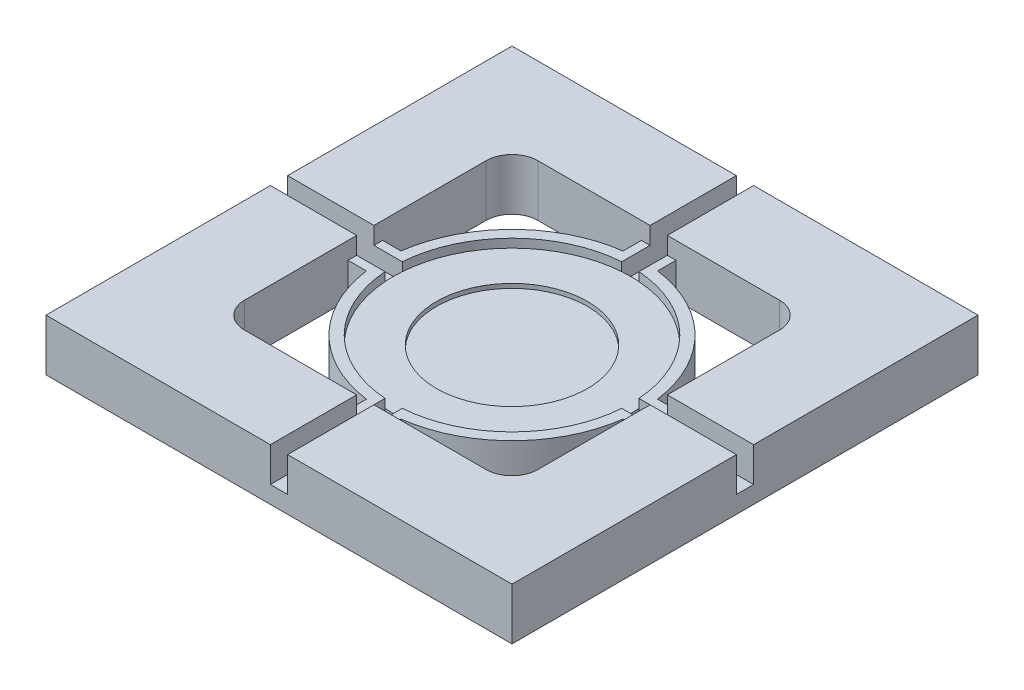
from build123d import *

# Parameters (mm, degrees)
SKETCH1_W             = 54
SKETCH1_H             = 54
BOSS_EXTRUDE1_DEPTH   = 10
CUT_EXTRUDE2_DEPTH    = 40.471508712
CUT_EXTRUDE3_DEPTH    = 2
SKETCH4_R             = 13.75
CUT_EXTRUDE4_DEPTH    = 1
SKETCH5_W             = 2
SKETCH5_H             = 10
SKETCH5_W_2           = 10
SKETCH5_H_2           = 2
CUT_EXTRUDE5_DEPTH    = 4
SKETCH7_R             = 8.75
CUT_EXTRUDE7_DEPTH    = 0.5
CROQUIS1_W            = 54
CROQUIS1_H            = 54
CORTAR_EXTRUIR1_DEPTH = 4


with BuildPart() as part:
    # Sketch1 → Boss-Extrude1 (new body)
    with BuildSketch(Plane(origin=(0, 0, 0), x_dir=(1, 0, 0), z_dir=(0, 1, 0))):
        Rectangle(SKETCH1_W, SKETCH1_H)
    extrude(amount=BOSS_EXTRUDE1_DEPTH)

    # Sketch2 → Cut-Extrude2 (cut, through all)
    with BuildSketch(Plane(origin=(0, 10, 0), x_dir=(1, 0, 0), z_dir=(0, 1, 0))):
        with BuildLine():
            ThreePointArc((-17, -14), (-16.121320344, -16.121320344), (-14, -17))
            Line((-14, -17), (-2, -17))
            Line((-2, -17), (-2, -14.866068747))
            ThreePointArc((-2, -14.866068747), (-10.606601718, -10.606601718), (-14.866068747, -2))
            Line((-14.866068747, -2), (-17, -2))
            Line((-17, -2), (-17, -14))
        make_face()
        with BuildLine():
            Line((2, -14.866068747), (2, -17))
            Line((2, -17), (14, -17))
            ThreePointArc((14, -17), (16.121320344, -16.121320344), (17, -14))
            Line((17, -14), (17, -2))
            Line((17, -2), (14.866068747, -2))
            ThreePointArc((14.866068747, -2), (10.606601718, -10.606601718), (2, -14.866068747))
        make_face()
        with BuildLine():
            Line((-17, 14), (-17, 2))
            Line((-17, 2), (-14.866068747, 2))
            ThreePointArc((-14.866068747, 2), (-10.606601718, 10.606601718), (-2, 14.866068747))
            Line((-2, 14.866068747), (-2, 17))
            Line((-2, 17), (-14, 17))
            ThreePointArc((-14, 17), (-16.121320344, 16.121320344), (-17, 14))
        make_face()
        with BuildLine():
            Line((14.866068747, 2), (17, 2))
            Line((17, 2), (17, 14))
            ThreePointArc((17, 14), (16.121320344, 16.121320344), (14, 17))
            Line((14, 17), (2, 17))
            Line((2, 17), (2, 14.866068747))
            ThreePointArc((2, 14.866068747), (10.606601718, 10.606601718), (14.866068747, 2))
        make_face()
    extrude(amount=-CUT_EXTRUDE2_DEPTH, mode=Mode.SUBTRACT)

    # Sketch3 → Cut-Extrude3 (cut)
    with BuildSketch(Plane(origin=(0, 10, 0), x_dir=(1, 0, 0), z_dir=(0, 1, 0))):
        with BuildLine():
            Line((-14, -17), (14, -17))
            ThreePointArc((14, -17), (16.121320344, -16.121320344), (17, -14))
            Line((17, -14), (17, 14))
            ThreePointArc((17, 14), (16.121320344, 16.121320344), (14, 17))
            Line((14, 17), (-14, 17))
            ThreePointArc((-14, 17), (-16.121320344, 16.121320344), (-17, 14))
            Line((-17, 14), (-17, -14))
            ThreePointArc((-17, -14), (-16.121320344, -16.121320344), (-14, -17))
        make_face()
    extrude(amount=-CUT_EXTRUDE3_DEPTH, mode=Mode.SUBTRACT)

    # Sketch4 → Cut-Extrude4 (cut)
    with BuildSketch(Plane(origin=(0, 8, 0), x_dir=(1, 0, 0), z_dir=(0, 1, 0))):
        with Locations(Location((0, 0, 0), (0, 0, 270))):
            Circle(SKETCH4_R)
    extrude(amount=-CUT_EXTRUDE4_DEPTH, mode=Mode.SUBTRACT)

    # Sketch5 → Cut-Extrude5 (cut)
    with BuildSketch(Plane(origin=(0, 10, 0), x_dir=(1, 0, 0), z_dir=(0, 1, 0))):
        with Locations((0, -22)):
            Rectangle(SKETCH5_W, SKETCH5_H)
        with BuildLine():
            Line((1, -17), (1, -13.713588152))
            ThreePointArc((1, -13.713588152), (0, -13.75), (-1, -13.713588152))
            Line((-1, -13.713588152), (-1, -17))
            Line((-1, -17), (1, -17))
        make_face()
        with Locations((22, 0)):
            Rectangle(SKETCH5_W_2, SKETCH5_H_2)
        with BuildLine():
            Line((17, 1), (13.713588152, 1))
            ThreePointArc((13.713588152, 1), (13.75, 0), (13.713588152, -1))
            Line((13.713588152, -1), (17, -1))
            Line((17, -1), (17, 1))
        make_face()
        with BuildLine():
            Line((1, 17), (-1, 17))
            Line((-1, 17), (-1, 13.713588152))
            ThreePointArc((-1, 13.713588152), (0, 13.75), (1, 13.713588152))
            Line((1, 13.713588152), (1, 17))
        make_face()
        with Locations((0, 22)):
            Rectangle(SKETCH5_W, SKETCH5_H)
        with Locations((-22, 0)):
            Rectangle(SKETCH5_W_2, SKETCH5_H_2)
        with BuildLine():
            Line((-13.713588152, 1), (-17, 1))
            Line((-17, 1), (-17, -1))
            Line((-17, -1), (-13.713588152, -1))
            ThreePointArc((-13.713588152, -1), (-13.75, 0), (-13.713588152, 1))
        make_face()
    extrude(amount=-CUT_EXTRUDE5_DEPTH, mode=Mode.SUBTRACT)

    # Sketch7 → Cut-Extrude7 (cut)
    with BuildSketch(Plane(origin=(0, 7, 0), x_dir=(1, 0, 0), z_dir=(0, 1, 0))):
        with Locations(Location((0, 0, 0), (0, 0, 270))):
            Circle(SKETCH7_R)
    extrude(amount=-CUT_EXTRUDE7_DEPTH, mode=Mode.SUBTRACT)

    # Croquis1 → Cortar-Extruir1 (cut)
    with BuildSketch(Plane.XZ):
        Rectangle(CROQUIS1_W, CROQUIS1_H)
    extrude(amount=-CORTAR_EXTRUIR1_DEPTH, mode=Mode.SUBTRACT)


solid = part.part
